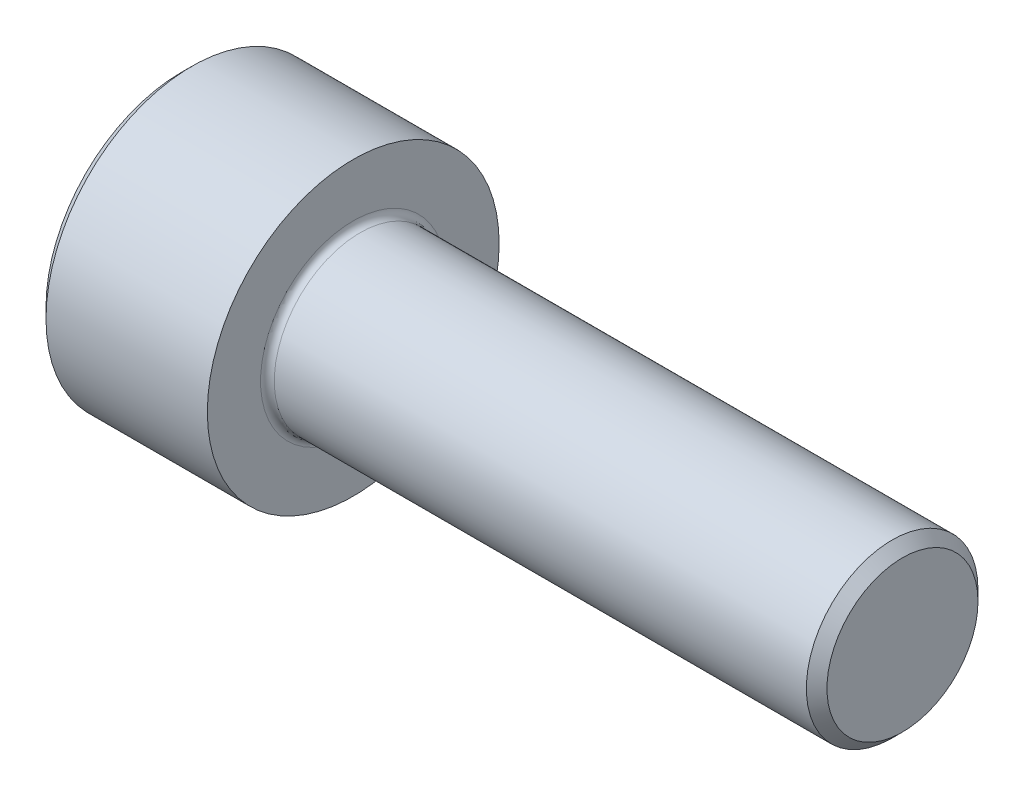
from build123d import *

# Parameters (mm, degrees)
ESBO_O1_W                = 5
ESBO_O1_H                = 4.25
ESBO_O2_R                = 2.5
RESSALTO_EXTRUS_O1_DEPTH = 16
CORTE_EXTRUS_O1_DEPTH    = 2.5
CHANFRO1_SIZE            = 0.3
FILETE1_R                = 0.2


with BuildPart() as part:
    # Esboço1 → Revolução1 (revolve)
    with BuildSketch(Plane(origin=(0, 0, 0), x_dir=(-1, 0, 0), z_dir=(0, 0, -1)), mode=Mode.PRIVATE) as revolu_o1_sk:
        with Locations((-2.5, 2.125)):
            Rectangle(ESBO_O1_W, ESBO_O1_H)
    revolve(revolu_o1_sk.sketch.rotate(Axis((5, 0, 0), (-1, 0, 0)), 270), axis=Axis((5, 0, 0), (-1, 0, 0)))

    # Esboço2 → Ressalto-extrusão1 (add)
    with BuildSketch(Plane(origin=(5, 0, 0), x_dir=(0, 0, -1), z_dir=(1, 0, 0))):
        Circle(ESBO_O2_R)
    extrude(amount=RESSALTO_EXTRUS_O1_DEPTH)

    # Esboço3 → Corte-extrusão1 (cut)
    with BuildSketch(Plane.ZY):
        Polygon((0, -2.357898499), (2.042, -1.17894925), (2.042, 1.17894925), (0, 2.357898499), (-2.042, 1.17894925), (-2.042, -1.17894925), align=None)
    extrude(amount=-CORTE_EXTRUS_O1_DEPTH, mode=Mode.SUBTRACT)

    # Esboço4 → Corte-Revolução1 (revolve, cut)
    with BuildSketch(Plane.XY, mode=Mode.PRIVATE) as corte_revolu_o1_sk:
        Polygon((2.5, 2.042), (2.5, 0), (3.67894925, 0), align=None)
    revolve(corte_revolu_o1_sk.sketch.rotate(Axis((2.5, 0, 0), (1, 0, 0)), 90), axis=Axis((2.5, 0, 0), (1, 0, 0)), mode=Mode.SUBTRACT)

    # Chanfro1
    chanfro1_edges = [part.edges().sort_by_distance(p)[0] for p in [
        (21, 0, 2.5),
        (0, 0, -4.25),
    ]]
    chamfer(chanfro1_edges, length=CHANFRO1_SIZE)

    # Filete1
    filete1_edges = [part.edges().sort_by_distance(p)[0] for p in [
        (5, 0, 2.5),
    ]]
    fillet(filete1_edges, radius=FILETE1_R)

    # Sketch1 → Cut-Revolve1 (revolve, cut)
    with BuildSketch(Plane(origin=(0, 0, 0), x_dir=(1, 0, 0), z_dir=(0, 1, 0))):
        Polygon((0, 2.36), (1.362546635, 0), (0, 0), align=None)
    revolve(axis=Axis((1.362546635, 0, 0), (1, 0, 0)), mode=Mode.SUBTRACT)


solid = part.part
